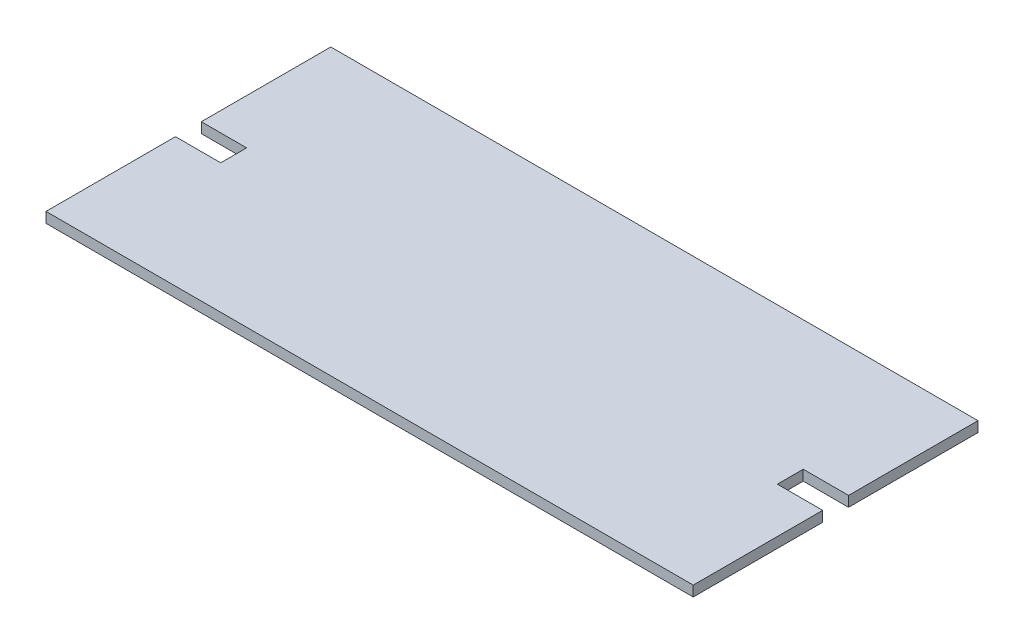
from build123d import *

# Parameters (mm, degrees)
BOSS_EXTRUDE1_DEPTH = 1.6


with BuildPart() as part:
    # Sketch2 → Boss-Extrude1 (new body)
    with BuildSketch(Plane(origin=(0, 0, 0), x_dir=(1, 0, 0), z_dir=(0, 1, 0))):
        Polygon((50, 22), (-50, 22), (-50, 2), (-43, 2), (-43, -2), (-50, -2), (-50, -22), (50, -22), (50, -2), (43, -2), (43, 2), (50, 2), align=None)
    extrude(amount=BOSS_EXTRUDE1_DEPTH)


solid = part.part
